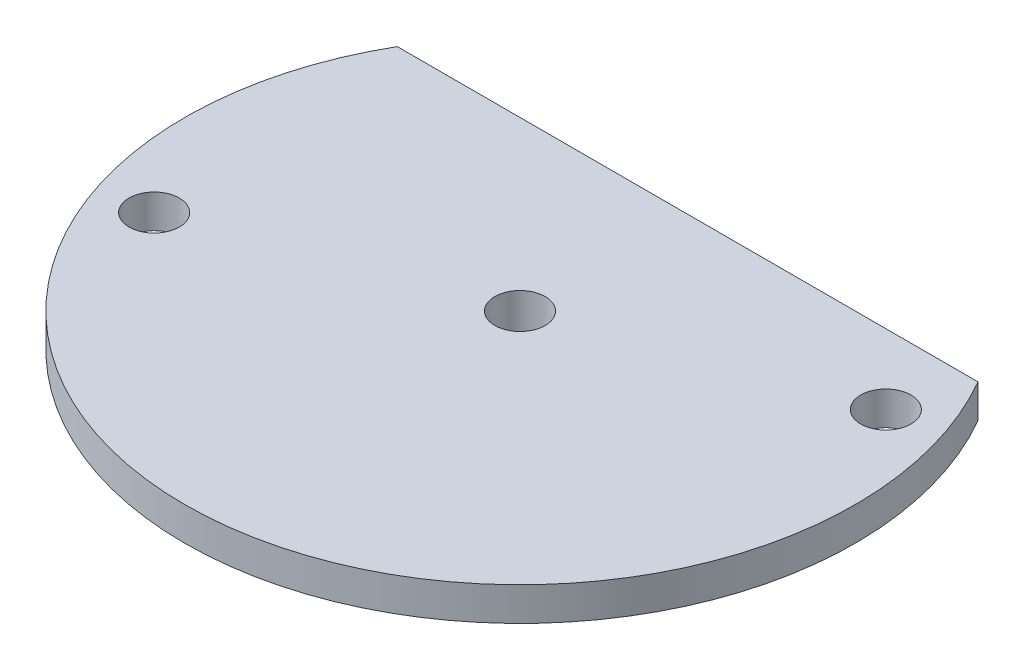
from build123d import *

# Parameters (mm, degrees)
CROQUIS1_R              = 1.5
SALIENTE_EXTRUIR1_DEPTH = 2
CROQUIS2_R              = 3
CROQUIS2_R_2            = 1.5
SALIENTE_EXTRUIR3_DEPTH = 6
CORTAR_EXTRUIR2_START   = -6
CROQUIS4_R              = 1.5
CORTAR_EXTRUIR2_DEPTH   = 6


with BuildPart() as part:
    # Croquis1 → Saliente-Extruir1 (new body)
    with BuildSketch(Plane(origin=(0, 0, 0), x_dir=(1, 0, 0), z_dir=(0, 1, 0))):
        with BuildLine():
            Line((-17.320508076, 10), (17.320508076, 10))
            ThreePointArc((17.320508076, 10), (0, -20), (-17.320508076, 10))
        make_face()
        with Locations(Location((-16, -5.823523748, 0), (0, 0, 270))):
            Circle(CROQUIS1_R, mode=Mode.SUBTRACT)
        with Locations(Location((16, 5.823523748, 0), (0, 0, 270))):
            Circle(CROQUIS1_R, mode=Mode.SUBTRACT)
    extrude(amount=SALIENTE_EXTRUIR1_DEPTH)

    # Croquis2 → Saliente-Extruir3 (add)
    with BuildSketch(Plane(origin=(0, 0, 0), x_dir=(1, 0, 0), z_dir=(0, 1, 0))):
        with Locations(Location((0, 0, 0), (0, 0, 270))):
            Circle(CROQUIS2_R)
        with Locations(Location((0, 0, 0), (0, 0, 270))):
            Circle(CROQUIS2_R_2, mode=Mode.SUBTRACT)
    extrude(amount=-SALIENTE_EXTRUIR3_DEPTH)

    # Croquis4 → Cortar-Extruir2 (cut)
    with BuildSketch(Plane.XZ.offset(CORTAR_EXTRUIR2_START)):
        with Locations(Location((0, 0, 0), (0, 0, 90))):
            Circle(CROQUIS4_R)
    extrude(amount=CORTAR_EXTRUIR2_DEPTH, mode=Mode.SUBTRACT)


solid = part.part
